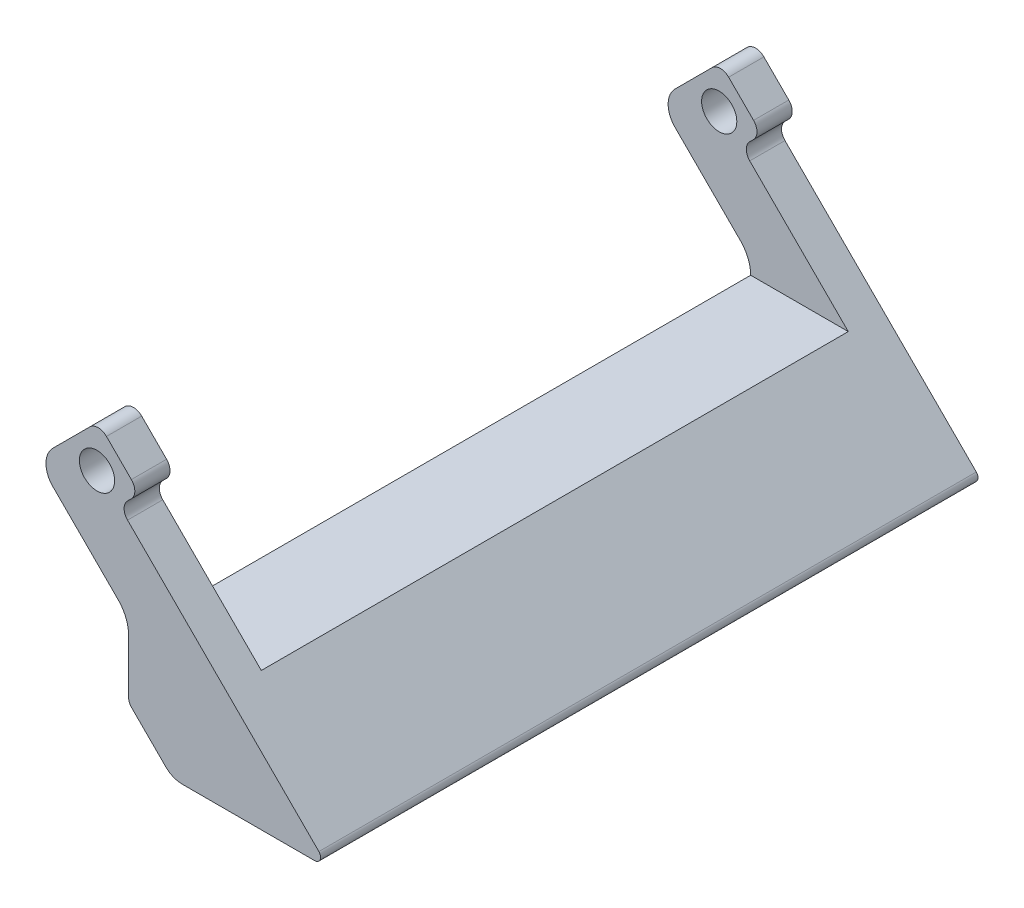
from build123d import *

# Parameters (mm, degrees)
SKETCH1_R           = 1.5
BOSS_EXTRUDE1_DEPTH = 3
BOSS_EXTRUDE2_DEPTH = 25
SKETCH6_W           = 56
SKETCH6_H           = 9.11547301
CUT_EXTRUDE1_DEPTH  = 63.91555103
FILLET1_R           = 2
FILLET2_R           = 1


with BuildPart() as part:
    # Sketch1 → Boss-Extrude1 (new body)
    with BuildSketch(Plane.XY):
        with BuildLine():
            Line((-3.762452186, -3.055345405), (1.803522753, -8.621320344))
            ThreePointArc((1.803522753, -8.621320344), (2.453841007, -9.59459039), (2.68220241, -10.742640687))
            Line((2.68220241, -10.742640687), (2.68220241, -18.5))
            ThreePointArc((2.68220241, -18.5), (2.975095629, -19.207106781), (3.68220241, -19.5))
            Line((3.68220241, -19.5), (18.54616344, -19.5))
            ThreePointArc((18.54616344, -19.5), (19.008103207, -19.191341716), (18.899716831, -18.646446609))
            Line((18.899716831, -18.646446609), (2.601508845, -2.348238623))
            ThreePointArc((2.601508845, -2.348238623), (2.308615626, -1.641131842), (2.601508845, -0.934025061))
            Line((2.601508845, -0.934025061), (2.927422074, -0.608111832))
            ThreePointArc((2.927422074, -0.608111832), (3.220315293, 0.098994949), (2.927422074, 0.806101731))
            Line((2.927422074, 0.806101731), (0.806101731, 2.927422074))
            ThreePointArc((0.806101731, 2.927422074), (0.098994949, 3.220315293), (-0.608111832, 2.927422074))
            Line((-0.608111832, 2.927422074), (-1.641131842, 1.894402064))
            Line((-1.641131842, 1.894402064), (-3.762452186, -0.22691828))
            ThreePointArc((-3.762452186, -0.22691828), (-4.348238623, -1.641131842), (-3.762452186, -3.055345405))
        make_face()
        Circle(SKETCH1_R, mode=Mode.SUBTRACT)
    boss_extrude1 = extrude(amount=BOSS_EXTRUDE1_DEPTH)

    # Sketch2 → Boss-Extrude2 (add)
    with BuildSketch(Plane.XY.offset(3)):
        with BuildLine():
            Line((18.899716831, -18.646446609), (10.995910909, -10.742640687))
            Line((10.995910909, -10.742640687), (2.68220241, -10.742640687))
            Line((2.68220241, -10.742640687), (2.68220241, -18.5))
            ThreePointArc((2.68220241, -18.5), (2.975095629, -19.207106781), (3.68220241, -19.5))
            Line((3.68220241, -19.5), (18.54616344, -19.5))
            ThreePointArc((18.54616344, -19.5), (19.008103207, -19.191341716), (18.899716831, -18.646446609))
        make_face()
    boss_extrude2 = extrude(amount=BOSS_EXTRUDE2_DEPTH)

    # Mirror1: Boss-Extrude1, Boss-Extrude2 across plane
    add(boss_extrude1.mirror(Plane.XY.offset(28)))
    add(boss_extrude2.mirror(Plane.XY.offset(28)))

    # Sketch6 → Cut-Extrude1 (cut, through all)
    with BuildSketch(Plane(origin=(-6.530219139, -6.530219139, 0), x_dir=(0, 0, 1), z_dir=(-0.7071067811865487, -0.7071067811865465, 0))):
        with Locations((28, -17.586068001)):
            Rectangle(SKETCH6_W, SKETCH6_H)
    extrude(amount=CUT_EXTRUDE1_DEPTH, mode=Mode.SUBTRACT)

    # Fillet1
    fillet1_edges = [part.edges().sort_by_distance(p)[0] for p in [
        (6.439561723, -19.5, 28),
    ]]
    fillet(fillet1_edges, radius=FILLET1_R)

    # Fillet2
    fillet2_edges = [part.edges().sort_by_distance(p)[0] for p in [
        (2.68220241, -15.742640687, 28),
    ]]
    fillet(fillet2_edges, radius=FILLET2_R)


solid = part.part
